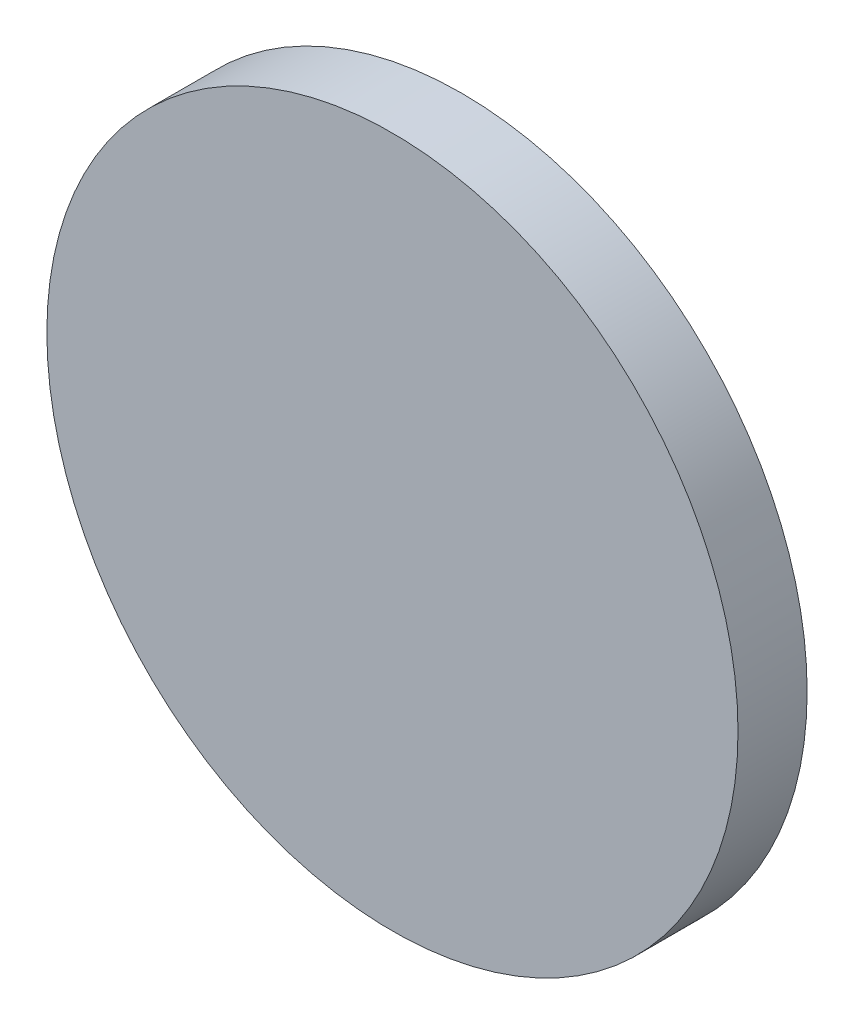
from build123d import *

# Parameters (mm, degrees)
SKETCH1_R           = 40.564550707
BOSS_EXTRUDE1_DEPTH = 10
BOSS_EXTRUDE2_DEPTH = 5.38
SKETCH5_R           = 76.2
BOSS_EXTRUDE3_DEPTH = 5.583348686
BOSS_EXTRUDE4_START = 9.66
SKETCH5_2_R         = 76.2
BOSS_EXTRUDE4_DEPTH = 9.66


with BuildPart() as part:
    # Sketch1 → Boss-Extrude1 (new body)
    with BuildSketch(Plane.XY):
        Circle(SKETCH1_R)
    extrude(amount=BOSS_EXTRUDE1_DEPTH)

    # Sketch2 → Boss-Extrude2 (add)
    with BuildSketch(Plane(origin=(0, 0, 0), x_dir=(-1, 0, 0), z_dir=(0, 0, -1))):
        with BuildLine():
            ThreePointArc((18.605098838, 17.572080057), (25.140246466, 15.180270653), (24.214003726, 8.283098686))
            ThreePointArc((24.214003726, 8.283098686), (25.586626057, 0.502262214), (24.520417146, -7.326448205))
            ThreePointArc((24.520417146, -7.326448205), (25.716623254, -14.181956771), (19.280375747, -16.828393011))
            ThreePointArc((19.280375747, -16.828393011), (13.228284865, -21.907537055), (5.915318308, -24.898528262))
            ThreePointArc((5.915318308, -24.898528262), (0.576376788, -29.362227423), (-4.933627979, -25.111491697))
            ThreePointArc((-4.933627979, -25.111491697), (-12.358341192, -22.409799269), (-18.605098838, -17.572080057))
            ThreePointArc((-18.605098838, -17.572080057), (-25.140246466, -15.180270653), (-24.214003726, -8.283098686))
            ThreePointArc((-24.214003726, -8.283098686), (-25.586626057, -0.502262214), (-24.520417146, 7.326448205))
            ThreePointArc((-24.520417146, 7.326448205), (-25.716623254, 14.181956771), (-19.280375747, 16.828393011))
            ThreePointArc((-19.280375747, 16.828393011), (-13.228284865, 21.907537055), (-5.915318308, 24.898528262))
            ThreePointArc((-5.915318308, 24.898528262), (-0.576376788, 29.362227423), (4.933627979, 25.111491697))
            ThreePointArc((4.933627979, 25.111491697), (12.358341192, 22.409799269), (18.605098838, 17.572080057))
        make_face()
    extrude(amount=BOSS_EXTRUDE2_DEPTH)

    # Sketch4 → Cut-Revolve2 (revolve, cut)
    with BuildSketch(Plane(origin=(0, 0, 0), x_dir=(0, 0, -1), z_dir=(0.9998069773781536, -0.01964708594067849, 0)), mode=Mode.PRIVATE) as cut_revolve2_sk:
        Polygon((0.153479633, 36.092584483), (0.153479633, 40.603125703), (-4.416651314, 40.603125703), (-4.416651314, 35.514398024), (-3.556, 32.394803966), (-3.556, 29.327755228), (0.657751111, 29.301116836), align=None)
    revolve(cut_revolve2_sk.sketch.rotate(Axis((0, 0, 95.775716375), (0, 0, -1)), 178.874232462), axis=Axis((0, 0, 95.775716375), (0, 0, -1)), mode=Mode.SUBTRACT)

    # Sketch5 → Boss-Extrude3 (add)
    with BuildSketch(Plane.XY.offset(10)):
        Circle(SKETCH5_R)
    extrude(amount=-BOSS_EXTRUDE3_DEPTH)

    # Sketch5<2> → Boss-Extrude4 (add)
    with BuildSketch(Plane.XY.offset(10).offset(BOSS_EXTRUDE4_START)):
        Circle(SKETCH5_2_R)
    extrude(amount=-BOSS_EXTRUDE4_DEPTH)


solid = part.part
